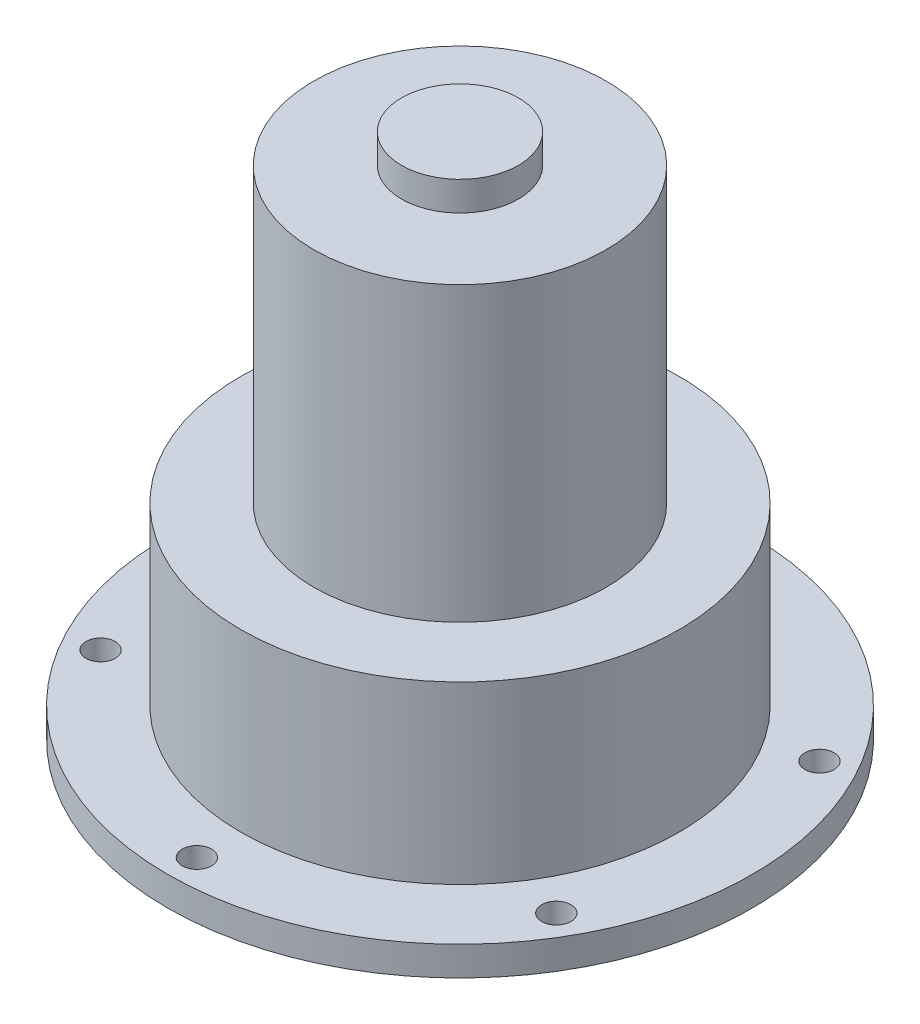
from build123d import *

# Parameters (mm, degrees)
SKETCH1_R           = 37.5
BOSS_EXTRUDE1_DEPTH = 30
SKETCH2_R           = 25
BOSS_EXTRUDE2_DEPTH = 50
SKETCH3_R           = 10
BOSS_EXTRUDE3_DEPTH = 5
SKETCH4_R           = 50
BOSS_EXTRUDE4_DEPTH = 5
SKETCH5_R           = 2.5
CUT_EXTRUDE1_DEPTH  = 5


with BuildPart() as part:
    # Sketch1 → Boss-Extrude1 (new body)
    with BuildSketch(Plane(origin=(0, 0, 0), x_dir=(1, 0, 0), z_dir=(0, 1, 0))):
        with Locations(Location((0, 0, 0), (0, 0, 270))):
            Circle(SKETCH1_R)
    extrude(amount=BOSS_EXTRUDE1_DEPTH)

    # Sketch2 → Boss-Extrude2 (add)
    with BuildSketch(Plane(origin=(0, 30, 0), x_dir=(1, 0, 0), z_dir=(0, 1, 0))):
        with Locations(Location((0, 0, 0), (0, 0, 270))):
            Circle(SKETCH2_R)
    extrude(amount=BOSS_EXTRUDE2_DEPTH)

    # Sketch3 → Boss-Extrude3 (add)
    with BuildSketch(Plane(origin=(0, 80, 0), x_dir=(1, 0, 0), z_dir=(0, 1, 0))):
        with Locations(Location((0, 0, 0), (0, 0, 270))):
            Circle(SKETCH3_R)
    extrude(amount=BOSS_EXTRUDE3_DEPTH)

    # Sketch4 → Boss-Extrude4 (add)
    with BuildSketch(Plane.XZ):
        with Locations(Location((0, 0, 0), (0, 0, 270))):
            Circle(SKETCH4_R)
    extrude(amount=BOSS_EXTRUDE4_DEPTH)

    # Sketch5 → Cut-Extrude1 (cut)
    with BuildSketch(Plane.XZ.offset(5)):
        with Locations(Location((0, 45, 0), (0, 0, 270))):
            Circle(SKETCH5_R)
        with Locations(Location((38.97114317, 22.5, 0), (0, 0, 270))):
            Circle(SKETCH5_R)
        with Locations(Location((38.97114317, -22.5, 0), (0, 0, 270))):
            Circle(SKETCH5_R)
        with Locations(Location((0, -45, 0), (0, 0, 270))):
            Circle(SKETCH5_R)
        with Locations(Location((-38.97114317, -22.5, 0), (0, 0, 270))):
            Circle(SKETCH5_R)
        with Locations(Location((-38.97114317, 22.5, 0), (0, 0, 270))):
            Circle(SKETCH5_R)
    extrude(amount=-CUT_EXTRUDE1_DEPTH, mode=Mode.SUBTRACT)


solid = part.part
